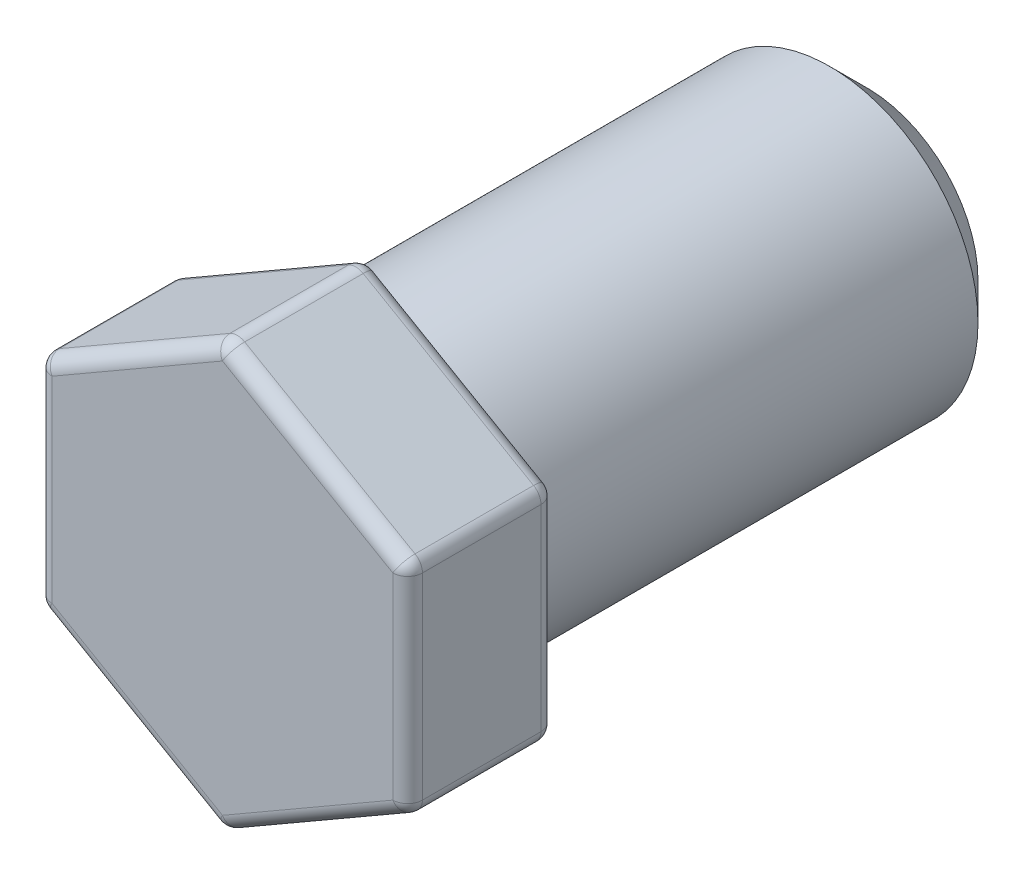
from build123d import *

# Parameters (mm, degrees)
SKETCH1_R           = 2
BOSS_EXTRUDE1_DEPTH = 6.7
BOSS_EXTRUDE2_DEPTH = 2
FILLET1_R           = 0.2
FILLET2_R           = 0.2
CHAMFER1_SIZE       = 0.5


with BuildPart() as part:
    # Sketch1 → Boss-Extrude1 (new body)
    with BuildSketch(Plane.XY):
        Circle(SKETCH1_R)
    extrude(amount=BOSS_EXTRUDE1_DEPTH)

    # Sketch2 → Boss-Extrude2 (add)
    with BuildSketch(Plane.XY.offset(6.7)):
        Polygon((2.5, -1.443375673), (2.5, 1.443375673), (0, 2.886751346), (-2.5, 1.443375673), (-2.5, -1.443375673), (0, -2.886751346), align=None)
    extrude(amount=BOSS_EXTRUDE2_DEPTH)

    # Fillet1
    fillet1_edges = [part.edges().sort_by_distance(p)[0] for p in [
        (-2, 0, 6.7),
        (1.25, -2.165063509, 6.7),
        (2.5, 0, 6.7),
        (1.25, 2.165063509, 6.7),
        (-1.25, 2.165063509, 6.7),
        (-2.5, 0, 6.7),
        (-1.25, -2.165063509, 6.7),
        (1.25, -2.165063509, 8.7),
        (2.5, 0, 8.7),
        (1.25, 2.165063509, 8.7),
        (-1.25, 2.165063509, 8.7),
        (-2.5, 0, 8.7),
        (-1.25, -2.165063509, 8.7),
    ]]
    fillet(fillet1_edges, radius=FILLET1_R)

    # Fillet2
    fillet2_edges = [part.edges().sort_by_distance(p)[0] for p in [
        (0, -2.886751346, 7.7),
        (-2.5, -1.443375673, 7.7),
        (-2.5, 1.443375673, 7.7),
        (0, 2.886751346, 7.7),
        (2.5, 1.443375673, 7.7),
        (2.5, -1.443375673, 7.7),
        (0, 2.813180543, 8.64637683),
        (2.436285816, 1.406590271, 8.64637683),
        (-2.436285816, 1.406590271, 8.64637683),
        (2.436285816, -1.406590271, 8.64637683),
        (-2.436285816, -1.406590271, 8.64637683),
        (0, -2.813180543, 8.64637683),
        (-2.436285816, -1.406590271, 6.75362317),
        (-2.436285816, 1.406590271, 6.75362317),
        (0, -2.813180543, 6.75362317),
        (0, 2.813180543, 6.75362317),
        (2.436285816, -1.406590271, 6.75362317),
        (2.436285816, 1.406590271, 6.75362317),
    ]]
    fillet(fillet2_edges, radius=FILLET2_R)

    # Chamfer1
    chamfer1_edges = [part.edges().sort_by_distance(p)[0] for p in [
        (-2, 0, 0),
    ]]
    chamfer(chamfer1_edges, length=CHAMFER1_SIZE)


solid = part.part
